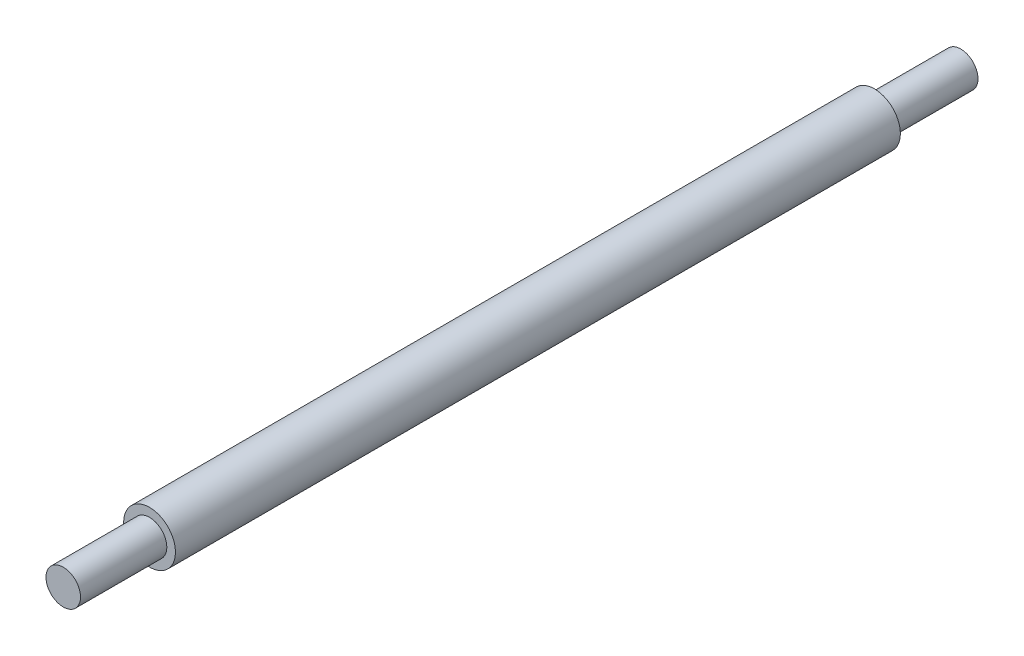
from build123d import *


with BuildPart() as part:
    # Sketch2 → Revolve1 (revolve)
    with BuildSketch(Plane(origin=(0, 0, 0), x_dir=(0, 0, -1), z_dir=(1, 0, 0))):
        Polygon((0, 0), (0, 2), (10, 2), (10, 3), (94, 3), (94, 2), (104, 2), (104, 0), align=None)
    revolve(axis=Axis((0, 0, -104), (0, 0, 1)))


solid = part.part
